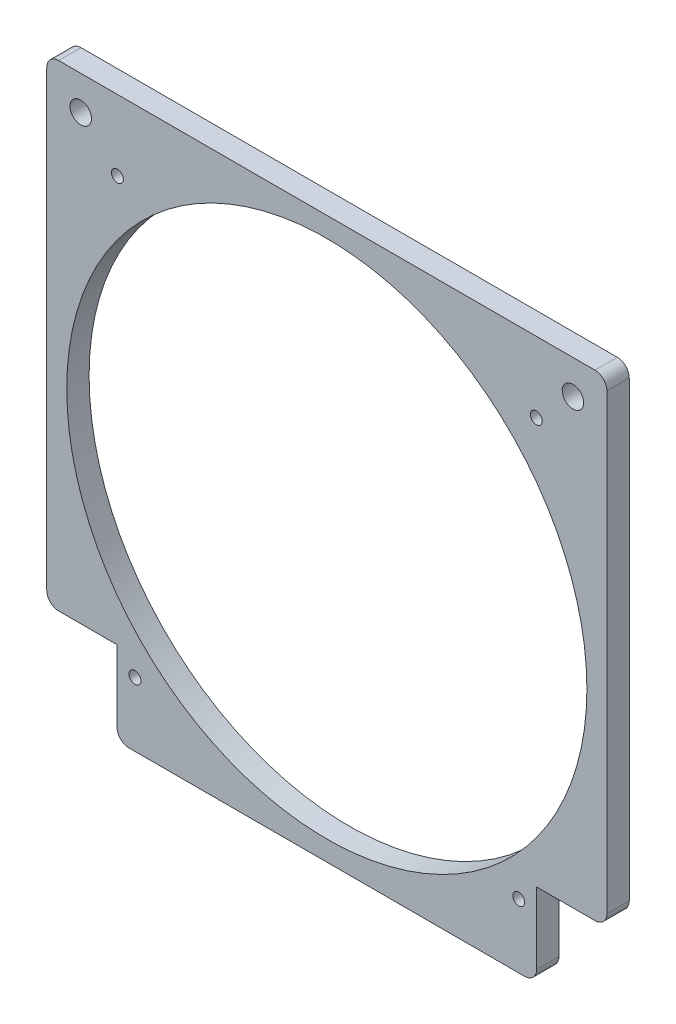
from build123d import *

# Parameters (mm, degrees)
SKETCH1_W           = 119.38
SKETCH1_H           = 119.38
BOSS_EXTRUDE1_DEPTH = 4.7625
CUT_EXTRUDE1_REACH  = 131.937
SKETCH2_R           = 2.286
SKETCH2_R_2         = 1.27
SKETCH2_R_3         = 55.42912263
CUT_EXTRUDE2_REACH  = 131.937
SKETCH4_W           = 14.986
SKETCH4_H           = 17.78
FILLET2_R           = 2.54
FILLET3_R           = 2.54


with BuildPart() as part:
    # Sketch1 → Boss-Extrude1 (new body)
    with BuildSketch(Plane.XY):
        with Locations((-31.19657191, 33.049217791)):
            Rectangle(SKETCH1_W, SKETCH1_H)
    extrude(amount=BOSS_EXTRUDE1_DEPTH)

    # Sketch2 → Cut-Extrude1 (cut, up to next)
    with BuildSketch(Plane(origin=(0, 0, 0), x_dir=(-1, 0, 0), z_dir=(0, 0, -1)), mode=Mode.PRIVATE) as cut_extrude1_sk1:
        with Locations((-21.25442809, 85.500217791)):
            Circle(SKETCH2_R)
    cut_extrude1_tool1 = extrude(cut_extrude1_sk1.sketch, amount=-CUT_EXTRUDE1_REACH, mode=Mode.PRIVATE) & part.part
    # Sketch2 → Cut-Extrude1 (cut, up to next)
    with BuildSketch(Plane(origin=(0, 0, 0), x_dir=(-1, 0, 0), z_dir=(0, 0, -1)), mode=Mode.PRIVATE) as cut_extrude1_sk2:
        with Locations((83.64757191, 85.500217791)):
            Circle(SKETCH2_R)
    cut_extrude1_tool2 = extrude(cut_extrude1_sk2.sketch, amount=-CUT_EXTRUDE1_REACH, mode=Mode.PRIVATE) & part.part
    # Sketch2 → Cut-Extrude1 (cut, up to next)
    with BuildSketch(Plane(origin=(0, 0, 0), x_dir=(-1, 0, 0), z_dir=(0, 0, -1)), mode=Mode.PRIVATE) as cut_extrude1_sk3:
        with Locations(Location((72.09057191, -12.988282209, 0), (0, 0, 180))):
            Circle(SKETCH2_R_2)
    cut_extrude1_tool3 = extrude(cut_extrude1_sk3.sketch, amount=-CUT_EXTRUDE1_REACH, mode=Mode.PRIVATE) & part.part
    # Sketch2 → Cut-Extrude1 (cut, up to next)
    with BuildSketch(Plane(origin=(0, 0, 0), x_dir=(-1, 0, 0), z_dir=(0, 0, -1)), mode=Mode.PRIVATE) as cut_extrude1_sk4:
        with Locations((31.19657191, 33.049217791)):
            Circle(SKETCH2_R_3)
    cut_extrude1_tool4 = extrude(cut_extrude1_sk4.sketch, amount=-CUT_EXTRUDE1_REACH, mode=Mode.PRIVATE) & part.part
    # Sketch2 → Cut-Extrude1 (cut, up to next)
    with BuildSketch(Plane(origin=(0, 0, 0), x_dir=(-1, 0, 0), z_dir=(0, 0, -1)), mode=Mode.PRIVATE) as cut_extrude1_sk5:
        with Locations((-13.44392809, 77.689717791)):
            Circle(SKETCH2_R_2)
    cut_extrude1_tool5 = extrude(cut_extrude1_sk5.sketch, amount=-CUT_EXTRUDE1_REACH, mode=Mode.PRIVATE) & part.part
    # Sketch2 → Cut-Extrude1 (cut, up to next)
    with BuildSketch(Plane(origin=(0, 0, 0), x_dir=(-1, 0, 0), z_dir=(0, 0, -1)), mode=Mode.PRIVATE) as cut_extrude1_sk6:
        with Locations(Location((75.83707191, 77.689717791, 0), (0, 0, 180))):
            Circle(SKETCH2_R_2)
    cut_extrude1_tool6 = extrude(cut_extrude1_sk6.sketch, amount=-CUT_EXTRUDE1_REACH, mode=Mode.PRIVATE) & part.part
    # Sketch2 → Cut-Extrude1 (cut, up to next)
    with BuildSketch(Plane(origin=(0, 0, 0), x_dir=(-1, 0, 0), z_dir=(0, 0, -1)), mode=Mode.PRIVATE) as cut_extrude1_sk7:
        with Locations((-9.69742809, -12.988282209)):
            Circle(SKETCH2_R_2)
    cut_extrude1_tool7 = extrude(cut_extrude1_sk7.sketch, amount=-CUT_EXTRUDE1_REACH, mode=Mode.PRIVATE) & part.part
    add(cut_extrude1_tool1.solids().sort_by_distance((21.254428, 85.500218, 0))[0], mode=Mode.SUBTRACT)
    add(cut_extrude1_tool2.solids().sort_by_distance((-83.647572, 85.500218, 0))[0], mode=Mode.SUBTRACT)
    add(cut_extrude1_tool3.solids().sort_by_distance((-72.090572, -12.988282, 0))[0], mode=Mode.SUBTRACT)
    add(cut_extrude1_tool4.solids().sort_by_distance((-31.196572, 33.049218, 0))[0], mode=Mode.SUBTRACT)
    add(cut_extrude1_tool5.solids().sort_by_distance((13.443928, 77.689718, 0))[0], mode=Mode.SUBTRACT)
    add(cut_extrude1_tool6.solids().sort_by_distance((-75.837072, 77.689718, 0))[0], mode=Mode.SUBTRACT)
    add(cut_extrude1_tool7.solids().sort_by_distance((9.697428, -12.988282, 0))[0], mode=Mode.SUBTRACT)

    # Sketch4 → Cut-Extrude2 (cut, up to next)
    with BuildSketch(Plane(origin=(0, 0, 0), x_dir=(-1, 0, 0), z_dir=(0, 0, -1)), mode=Mode.PRIVATE) as cut_extrude2_sk1:
        with Locations((-21.00042809, -17.750782209)):
            Rectangle(SKETCH4_W, SKETCH4_H)
    cut_extrude2_tool1 = extrude(cut_extrude2_sk1.sketch, amount=-CUT_EXTRUDE2_REACH, mode=Mode.PRIVATE) & part.part
    # Sketch4 → Cut-Extrude2 (cut, up to next)
    with BuildSketch(Plane(origin=(0, 0, 0), x_dir=(-1, 0, 0), z_dir=(0, 0, -1)), mode=Mode.PRIVATE) as cut_extrude2_sk2:
        with Locations((83.39357191, -17.750782209)):
            Rectangle(SKETCH4_W, SKETCH4_H)
    cut_extrude2_tool2 = extrude(cut_extrude2_sk2.sketch, amount=-CUT_EXTRUDE2_REACH, mode=Mode.PRIVATE) & part.part
    add(cut_extrude2_tool1.solids().sort_by_distance((21.000428, -17.750782, 0))[0], mode=Mode.SUBTRACT)
    add(cut_extrude2_tool2.solids().sort_by_distance((-83.393572, -17.750782, 0))[0], mode=Mode.SUBTRACT)

    # Fillet2
    fillet2_edges = [part.edges().sort_by_distance(p)[0] for p in [
        (-90.88657191, 92.739217791, 2.38125),
        (28.49342809, 92.739217791, 2.38125),
    ]]
    fillet(fillet2_edges, radius=FILLET2_R)

    # Fillet3
    fillet3_edges = [part.edges().sort_by_distance(p)[0] for p in [
        (28.49342809, -8.860782209, 2.38125),
        (13.50742809, -26.640782209, 2.38125),
        (-75.90057191, -26.640782209, 2.38125),
        (-90.88657191, -8.860782209, 2.38125),
    ]]
    fillet(fillet3_edges, radius=FILLET3_R)


solid = part.part
